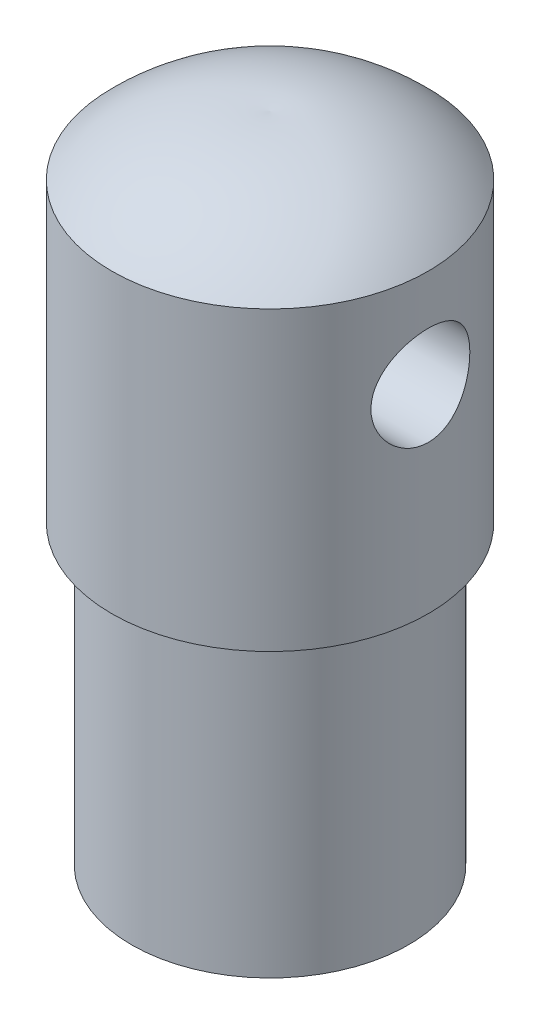
from build123d import *

# Parameters (mm, degrees)
SKETCH1_R               = 7
BOSS_EXTRUDE1_DEPTH     = 15
SKETCH2_R               = 8
BOSS_EXTRUDE2_DEPTH     = 15
CUT_EXTRUDE1_DEPTH      = 35.917798754
CUT_EXTRUDE1_DEPTH_BACK = 35.917798754
SKETCH3_R               = 2.5


with BuildPart() as part:
    # Sketch1 → Boss-Extrude1 (new body)
    with BuildSketch(Plane(origin=(0, 0, 0), x_dir=(1, 0, 0), z_dir=(0, 1, 0))):
        with Locations(Location((0, 0, 0), (0, 0, 270))):
            Circle(SKETCH1_R)
    extrude(amount=BOSS_EXTRUDE1_DEPTH)

    # Sketch2 → Boss-Extrude2 (add)
    with BuildSketch(Plane(origin=(0, 15, 0), x_dir=(1, 0, 0), z_dir=(0, 1, 0))):
        with Locations(Location((0, 0, 0), (0, 0, 270))):
            Circle(SKETCH2_R)
    extrude(amount=BOSS_EXTRUDE2_DEPTH)

    # Sketch4 → Revolve1 (revolve)
    with BuildSketch(Plane.XY):
        with BuildLine():
            Line((0, 33), (0, 30))
            Line((0, 30), (8, 30))
            ThreePointArc((8, 30), (4.336527008, 32.397405356), (0, 33))
        make_face()
    revolve(axis=Axis((0, 33, 0), (0, -1, 0)))

    # Sketch3 → Cut-Extrude1 (cut, two sides: drawn at the far end of the back side and taken through both)
    with BuildSketch(Plane(origin=(0, 0, 0), x_dir=(0, 0, -1), z_dir=(1, 0, 0)).offset(-CUT_EXTRUDE1_DEPTH_BACK)):
        with Locations((0, 25)):
            Circle(SKETCH3_R)
    extrude(amount=CUT_EXTRUDE1_DEPTH + CUT_EXTRUDE1_DEPTH_BACK, mode=Mode.SUBTRACT)


solid = part.part
